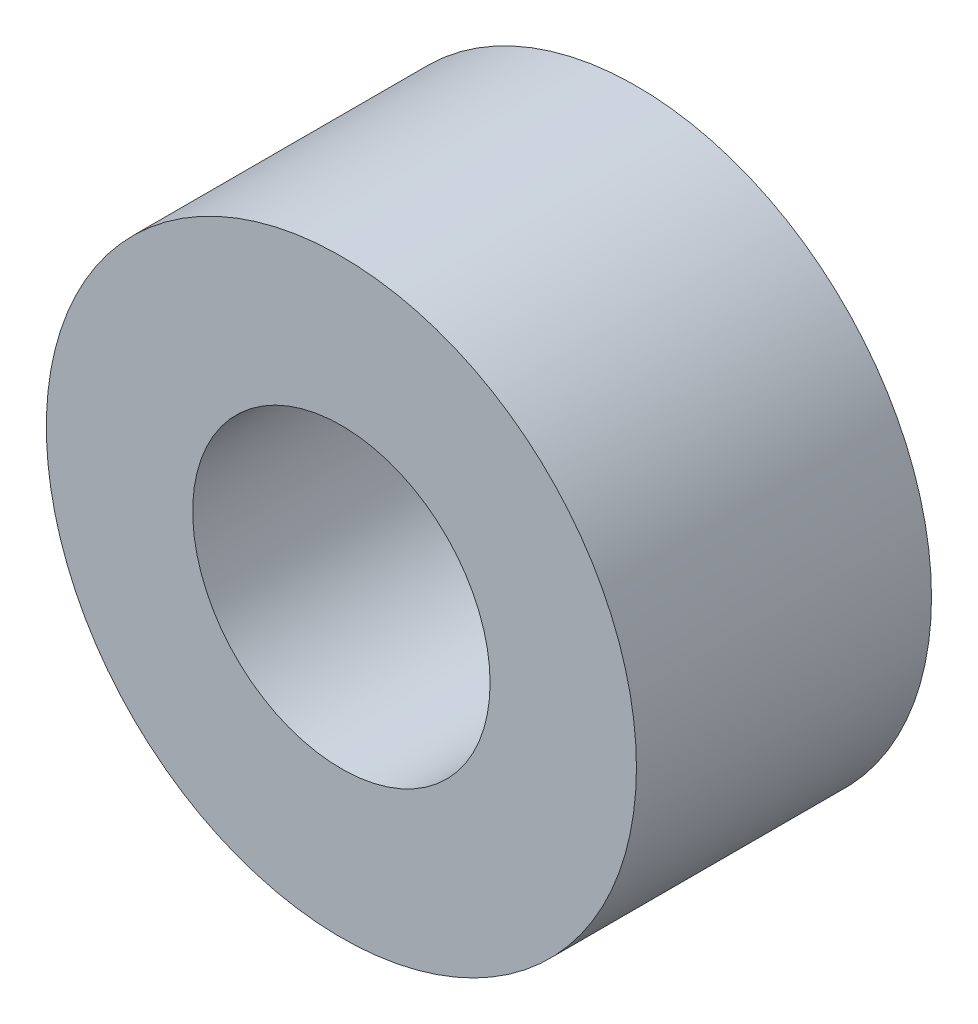
from build123d import *

# Parameters (mm, degrees)
SKETCH1_R      = 6.35
SKETCH1_R_2    = 3.2004
EXTRUDE1_DEPTH = 3.175


with BuildPart() as part:
    # Sketch1 → Extrude1 (new, symmetric)
    with BuildSketch(Plane.XY):
        Circle(SKETCH1_R)
        Circle(SKETCH1_R_2, mode=Mode.SUBTRACT)
    extrude(amount=EXTRUDE1_DEPTH, both=True)


solid = part.part
